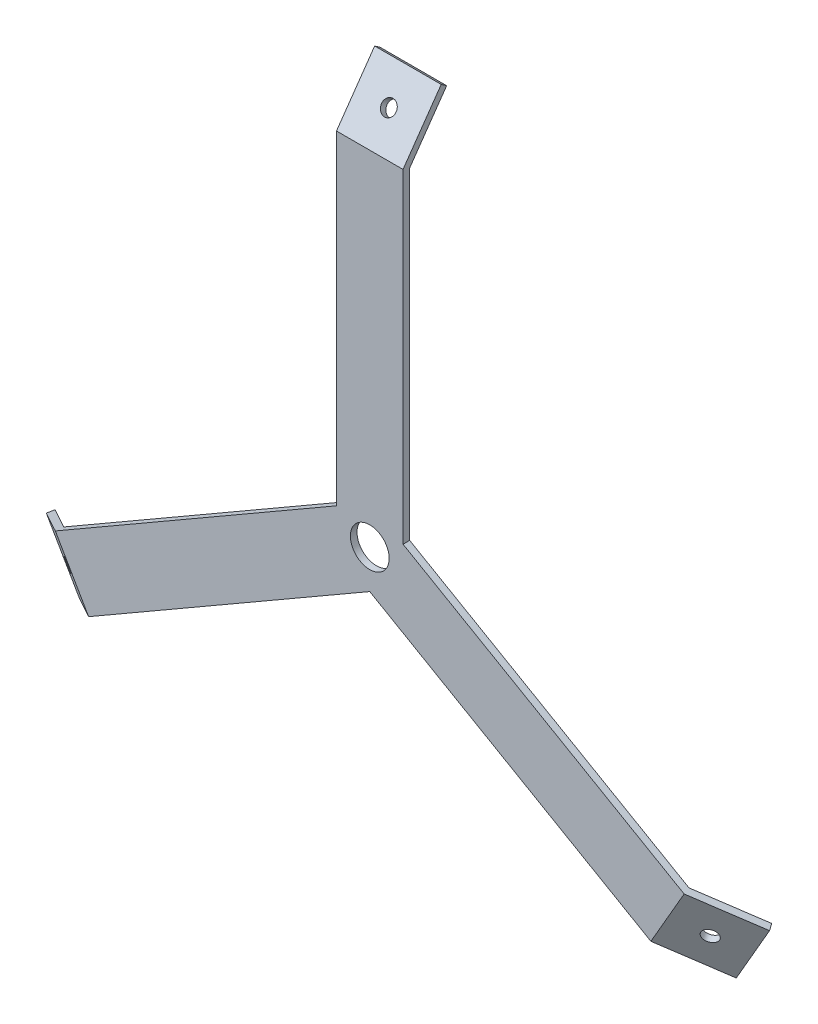
from build123d import *

# Parameters (mm, degrees)
EXTRUDE_1_DEPTH          = 15
PATTERN_CIRCULAR_1_COUNT = 3
HOLE_WIZARD_M161_D       = 17.5
HOLE_WIZARD_M62_D        = 6.6
PATTERN_CIRCULAR_2_COUNT = 3


with BuildPart() as part:
    # Эскиз1 → Вытянуть-Тонкостенный1 (new, symmetric)
    with BuildSketch(Plane(origin=(0, 0, 0), x_dir=(0, 0, -1), z_dir=(1, 0, 0))):
        Polygon((0, 0), (0, 155), (17.207293091, 179.574561329), (19.664749223, 177.85383202), (3, 154.054103633), (3, 0), align=None)
    extrude_1 = extrude(amount=EXTRUDE_1_DEPTH, both=True)

    # Круговой массив1: Вытянуть-Тонкостенный1 ×3 about axis
    pattern_circular_1_axis = Axis((0, 0, 0), (0, 0, 1))
    for i in range(1, PATTERN_CIRCULAR_1_COUNT):
        add(extrude_1.rotate(pattern_circular_1_axis, i * 360 / PATTERN_CIRCULAR_1_COUNT))

    # Отверстие с зазором M161 (through all)
    with Locations(Plane(origin=(0, 0, -3), x_dir=(-1, 0, 0), z_dir=(0, 0, -1))):
        with Locations((0, 0)):
            Hole(HOLE_WIZARD_M161_D / 2)

    # Отверстие с зазором M62 (through all)
    with Locations(Plane(origin=(0, 165.566551355, -11.061102678), x_dir=(0, -0.819152044289, 0.573576436351), z_dir=(0, -0.573576436351, -0.819152044289))):
        with Locations((0, 0)):
            hole_wizard_m62 = Hole(HOLE_WIZARD_M62_D / 2)

    # Круговой массив2: Отверстие с зазором M62 ×3 about axis
    pattern_circular_2_axis = Axis((0, 0, 0), (0, 0, -1))
    for i in range(1, PATTERN_CIRCULAR_2_COUNT):
        add(hole_wizard_m62.rotate(pattern_circular_2_axis, i * 360 / PATTERN_CIRCULAR_2_COUNT), mode=Mode.SUBTRACT)


solid = part.part
